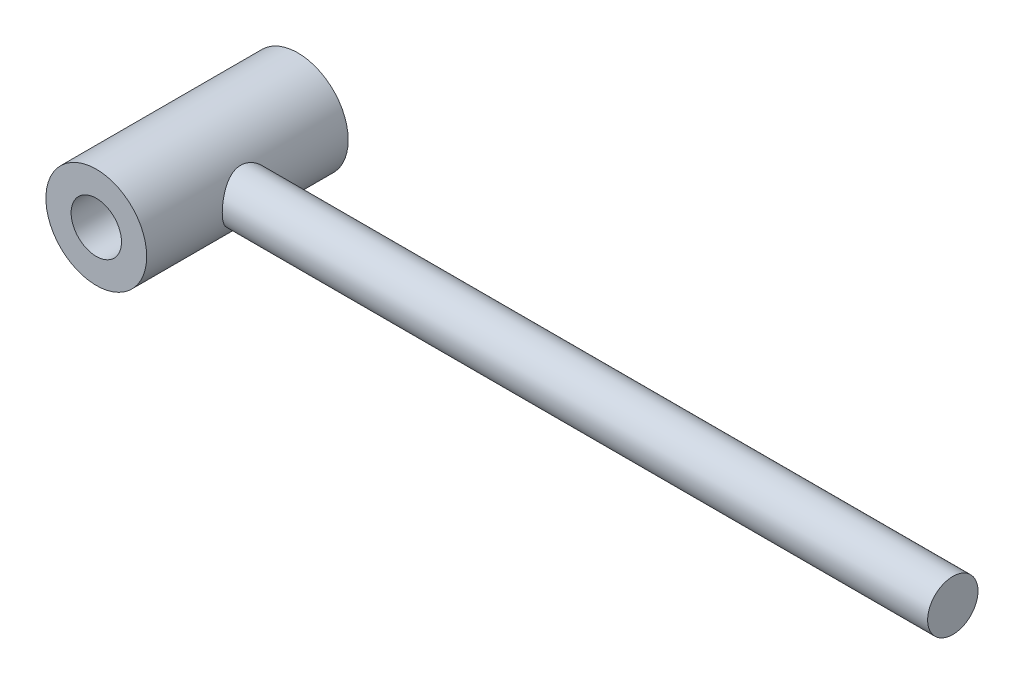
from build123d import *

# Parameters (mm, degrees)
ESQUISSE1_R                         = 5
ESQUISSE1_R_2                       = 2.5
BOSS_EXTRU_1_DEPTH                  = 20
ESQUISSE2_R                         = 2.5
BOSS_EXTRU_2_DEPTH                  = 70
BOSS_EXTRU_2_DIRECTION_2_REACH      = 24.913
BOSS_EXTRU_2_DIRECTION_2_END_RADIUS = 5


with BuildPart() as part:
    # Esquisse1 → Boss.-Extru.1 (new body)
    with BuildSketch(Plane.XY):
        Circle(ESQUISSE1_R)
        Circle(ESQUISSE1_R_2, mode=Mode.SUBTRACT)
    extrude(amount=BOSS_EXTRU_1_DEPTH)

    # Esquisse2 → Boss.-Extru.2 (add)
    with BuildSketch(Plane(origin=(5, 0, 0), x_dir=(0, 0, -1), z_dir=(1, 0, 0))):
        with Locations((-10, 0)):
            Circle(ESQUISSE2_R)
    extrude(amount=BOSS_EXTRU_2_DEPTH)

    # Boss.-Extru.2 direction 2: up to this cylinder (the profile starts outside it)
    boss_extru_2_direction_2_end = Plane(origin=(0, 0, 10), z_dir=(0, 0, -1)) * Cylinder(BOSS_EXTRU_2_DIRECTION_2_END_RADIUS, 60.826, mode=Mode.PRIVATE)
    # Esquisse2 → Boss.-Extru.2 direction 2 (add, up to the surface)
    with BuildSketch(Plane(origin=(5, 0, 0), x_dir=(0, 0, -1), z_dir=(1, 0, 0)), mode=Mode.PRIVATE) as boss_extru_2_direction_2_sk1:
        with Locations((-10, 0)):
            Circle(ESQUISSE2_R)
    boss_extru_2_direction_2_tool1 = extrude(boss_extru_2_direction_2_sk1.sketch, amount=-BOSS_EXTRU_2_DIRECTION_2_REACH, mode=Mode.PRIVATE) - boss_extru_2_direction_2_end
    add(boss_extru_2_direction_2_tool1.solids().sort_by_distance((5, 0, 10))[0])
    add(boss_extru_2_direction_2_tool1.solids().sort_by_distance((5, 0, 10))[1])


solid = part.part
